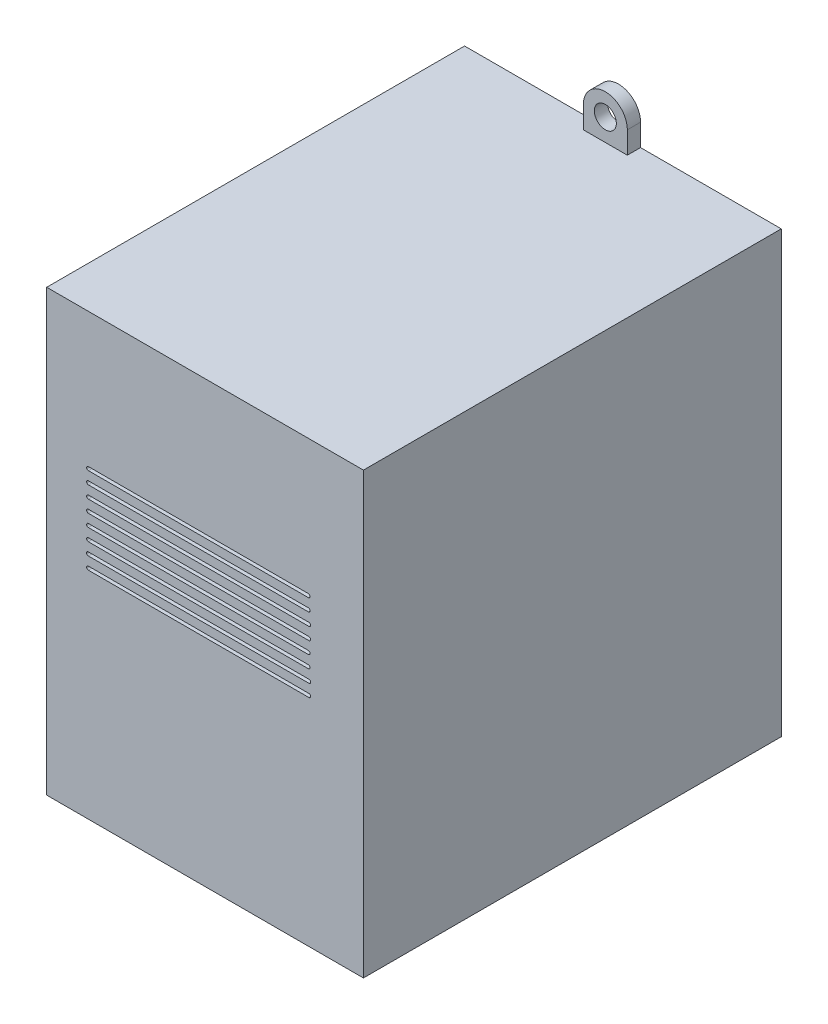
from build123d import *

# Parameters (mm, degrees)
ESBO_O1_W                = 72
ESBO_O1_H                = 100
ESBO_O1_W_2              = 66
ESBO_O1_H_2              = 94
RESSALTO_EXTRUS_O1_DEPTH = 92
ESBO_O2_W                = 72
ESBO_O2_H                = 100
RESSALTO_EXTRUS_O2_DEPTH = 3
RESSALTO_EXTRUS_O3_START = -95
ESBO_O3_R                = 2.5
RESSALTO_EXTRUS_O3_DEPTH = 3
CORTE_EXTRUS_O1_DEPTH    = 3
RESSALTO_EXTRUS_O4_START = 4
ESBO_O5_W                = 4
ESBO_O5_H                = 84
RESSALTO_EXTRUS_O4_DEPTH = 2


with BuildPart() as part:
    # Esboço1 → Ressalto-extrusão1 (new body)
    with BuildSketch(Plane.XY):
        with Locations((-15.908396947, 8.267175573)):
            Rectangle(ESBO_O1_W, ESBO_O1_H)
        with Locations((-15.908396947, 8.267175573)):
            Rectangle(ESBO_O1_W_2, ESBO_O1_H_2, mode=Mode.SUBTRACT)
    extrude(amount=RESSALTO_EXTRUS_O1_DEPTH)

    # Esboço2 → Ressalto-extrusão2 (add)
    with BuildSketch(Plane.XY.offset(92)):
        with Locations((-15.908396947, 8.267175573)):
            Rectangle(ESBO_O2_W, ESBO_O2_H)
    extrude(amount=RESSALTO_EXTRUS_O2_DEPTH)

    # Esboço3 → Ressalto-extrusão3 (add)
    # profile 1 of 2: a face of its own
    with BuildSketch(Plane.XY.offset(95).offset(RESSALTO_EXTRUS_O3_START)):
        with BuildLine():
            Line((-21.908396947, 58.267175573), (-21.908396947, 63.267175573))
            ThreePointArc((-21.908396947, 63.267175573), (-16.908396947, 68.267175573), (-11.908396947, 63.267175573))
            Line((-11.908396947, 63.267175573), (-11.908396947, 58.267175573))
            Line((-11.908396947, 58.267175573), (-21.908396947, 58.267175573))
        make_face()
        with Locations((-16.908396947, 63.267175573)):
            Circle(ESBO_O3_R, mode=Mode.SUBTRACT)
    # profile 2 of 2: a face of its own
    with BuildSketch(Plane.XY.offset(95).offset(RESSALTO_EXTRUS_O3_START)):
        with BuildLine():
            Line((-11.908396947, -46.732824427), (-11.908396947, -41.732824427))
            Line((-11.908396947, -41.732824427), (-21.908396947, -41.732824427))
            Line((-21.908396947, -41.732824427), (-21.908396947, -46.732824427))
            ThreePointArc((-21.908396947, -46.732824427), (-16.908396947, -51.732824427), (-11.908396947, -46.732824427))
        make_face()
        with Locations((-16.908396947, -46.732824427)):
            Circle(ESBO_O3_R, mode=Mode.SUBTRACT)
    extrude(amount=RESSALTO_EXTRUS_O3_DEPTH)

    # Esboço4 → Corte-extrusão1 (cut)
    with BuildSketch(Plane.XY.offset(95)):
        with BuildLine():
            Line((-42.438758468, 27.697077942), (7.561241532, 27.697077942))
            ThreePointArc((7.561241532, 27.697077942), (7.961241532, 27.297077942), (7.561241532, 26.897077942))
            Line((7.561241532, 26.897077942), (-42.438758468, 26.897077942))
            ThreePointArc((-42.438758468, 26.897077942), (-42.838758468, 27.297077942), (-42.438758468, 27.697077942))
        make_face()
        with BuildLine():
            Line((-42.438758468, 24.897077942), (7.561241532, 24.897077942))
            ThreePointArc((7.561241532, 24.897077942), (7.961241532, 24.497077942), (7.561241532, 24.097077942))
            Line((7.561241532, 24.097077942), (-42.438758468, 24.097077942))
            ThreePointArc((-42.438758468, 24.097077942), (-42.838758468, 24.497077942), (-42.438758468, 24.897077942))
        make_face()
        with BuildLine():
            Line((-42.438758468, 22.097077942), (7.705579096, 22.097077942))
            ThreePointArc((7.705579096, 22.097077942), (8.105579096, 21.697077942), (7.705579096, 21.297077942))
            Line((7.705579096, 21.297077942), (-42.438758468, 21.297077942))
            ThreePointArc((-42.438758468, 21.297077942), (-42.838758468, 21.697077942), (-42.438758468, 22.097077942))
        make_face()
        with BuildLine():
            Line((-42.438758468, 19.297077942), (7.705579096, 19.297077942))
            ThreePointArc((7.705579096, 19.297077942), (8.105579096, 18.897077942), (7.705579096, 18.497077942))
            Line((7.705579096, 18.497077942), (-42.438758468, 18.497077942))
            ThreePointArc((-42.438758468, 18.497077942), (-42.838758468, 18.897077942), (-42.438758468, 19.297077942))
        make_face()
        with BuildLine():
            Line((-42.438758468, 16.497077942), (7.561241532, 16.497077942))
            ThreePointArc((7.561241532, 16.497077942), (7.961241532, 16.097077942), (7.561241532, 15.697077942))
            Line((7.561241532, 15.697077942), (-42.438758468, 15.697077942))
            ThreePointArc((-42.438758468, 15.697077942), (-42.838758468, 16.097077942), (-42.438758468, 16.497077942))
        make_face()
        with BuildLine():
            Line((-42.438758468, 13.697077942), (7.561241532, 13.697077942))
            ThreePointArc((7.561241532, 13.697077942), (7.961241532, 13.297077942), (7.561241532, 12.897077942))
            Line((7.561241532, 12.897077942), (-42.438758468, 12.897077942))
            ThreePointArc((-42.438758468, 12.897077942), (-42.838758468, 13.297077942), (-42.438758468, 13.697077942))
        make_face()
        with BuildLine():
            Line((-42.438758468, 10.897077942), (7.705579175, 10.897077942))
            ThreePointArc((7.705579175, 10.897077942), (8.105579175, 10.497077942), (7.705579175, 10.097077942))
            Line((7.705579175, 10.097077942), (-42.438758468, 10.097077942))
            ThreePointArc((-42.438758468, 10.097077942), (-42.838758468, 10.497077942), (-42.438758468, 10.897077942))
        make_face()
        with BuildLine():
            Line((-42.438758468, 8.097077942), (7.705579175, 8.097077942))
            ThreePointArc((7.705579175, 8.097077942), (8.105579175, 7.697077942), (7.705579175, 7.297077942))
            Line((7.705579175, 7.297077942), (-42.438758468, 7.297077942))
            ThreePointArc((-42.438758468, 7.297077942), (-42.838758468, 7.697077942), (-42.438758468, 8.097077942))
        make_face()
    extrude(amount=-CORTE_EXTRUS_O1_DEPTH, mode=Mode.SUBTRACT)

    # Esboço5 → Ressalto-extrusão4 (add)
    with BuildSketch(Plane.XY.offset(RESSALTO_EXTRUS_O4_START)):
        with Locations((-46.908396947, 13.267175573)):
            Rectangle(ESBO_O5_W, ESBO_O5_H)
        with Locations((15.091603053, 13.267175573)):
            Rectangle(ESBO_O5_W, ESBO_O5_H)
    extrude(amount=RESSALTO_EXTRUS_O4_DEPTH)


solid = part.part
